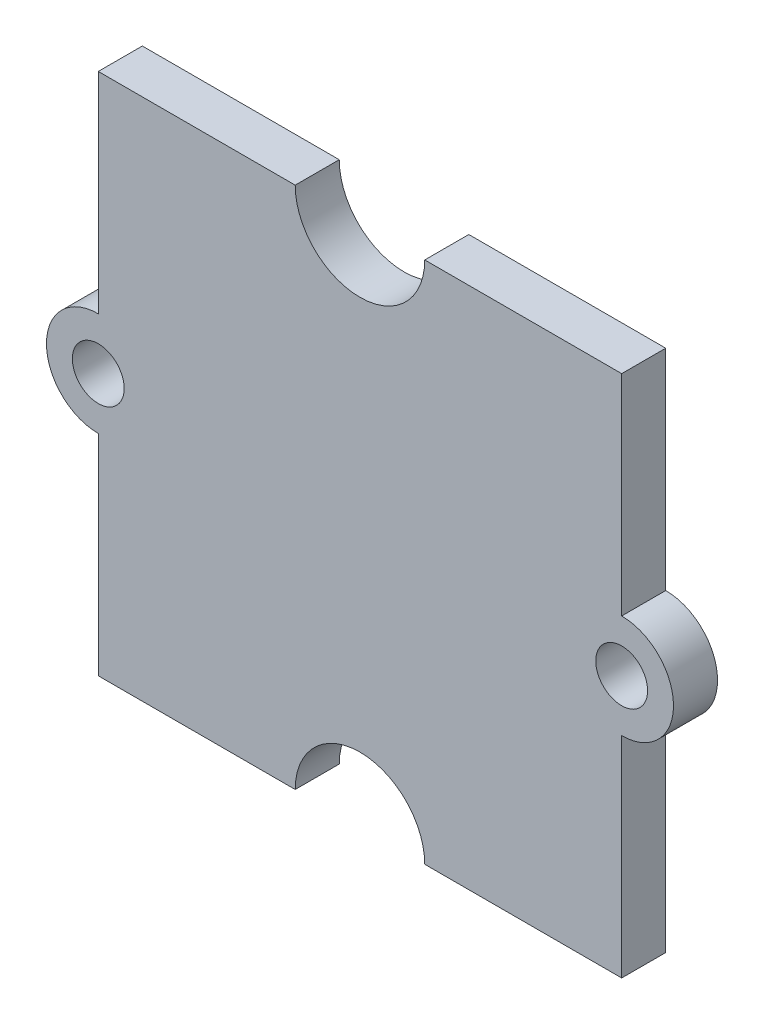
from build123d import *

# Parameters (mm, degrees)
CROQUIS1_R              = 1
SALIENTE_EXTRUIR1_DEPTH = 1.7


with BuildPart() as part:
    # Croquis1 → Saliente-Extruir1 (new body)
    with BuildSketch(Plane.XY):
        with BuildLine():
            Line((-2.5, 10.1), (-10.1, 10.1))
            Line((-10.1, 10.1), (-10.1, 2))
            ThreePointArc((-10.1, 2), (-12.1, 0), (-10.1, -2))
            Line((-10.1, -2), (-10.1, -10.1))
            Line((-10.1, -10.1), (-2.5, -10.1))
            ThreePointArc((-2.5, -10.1), (0, -7.6), (2.5, -10.1))
            Line((2.5, -10.1), (10.1, -10.1))
            Line((10.1, -10.1), (10.1, -2))
            ThreePointArc((10.1, -2), (12.1, 0), (10.1, 2))
            Line((10.1, 2), (10.1, 10.1))
            Line((10.1, 10.1), (2.5, 10.1))
            ThreePointArc((2.5, 10.1), (0, 7.6), (-2.5, 10.1))
        make_face()
        with Locations((-10.1, 0)):
            Circle(CROQUIS1_R, mode=Mode.SUBTRACT)
        with Locations((10.1, 0)):
            Circle(CROQUIS1_R, mode=Mode.SUBTRACT)
    extrude(amount=SALIENTE_EXTRUIR1_DEPTH)


solid = part.part
